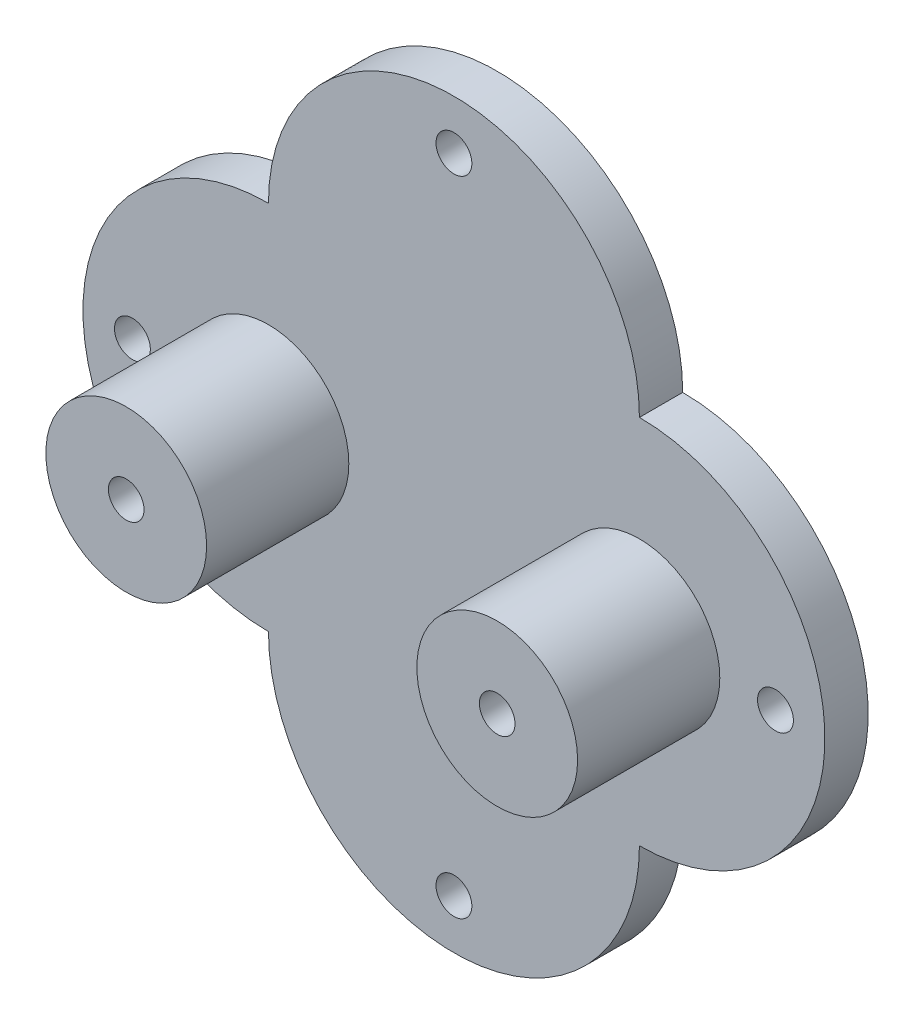
from build123d import *

# Parameters (mm, degrees)
EXTRUDE_9_DEPTH       = 2
SKETCH_5_R            = 6.5
SKETCH_5_R_2          = 1.44
EXTRUDE_11_DEPTH      = 9.7
EXTRUDE_12_DEPTH      = 3.5
SKETCH_5_4_R          = 6.5
SKETCH_5_4_R_2        = 1.44
EXTRUDE_13_DEPTH      = 10
EXTRUDE_17_DEPTH      = 10
EXTRUDE_17_DEPTH_BACK = 2
SKETCH_5_8_R          = 6.5
SKETCH_5_8_R_2        = 1.44
SKETCH_5_11_R         = 6.5
SKETCH_5_11_R_2       = 1.44
EXTRUDE_18_DEPTH      = 13
EXTRUDE_19_DEPTH      = 3
SKETCH_6_R            = 1.45
CUT_EXTRUDE_1_DEPTH   = 3.5


with BuildPart() as part:
    # 草图2 → 凸台-拉伸9 (new body)
    with BuildSketch(Plane.XY):
        with BuildLine():
            ThreePointArc((15, 15), (0, 30), (-15, 15))
            ThreePointArc((-15, 15), (-30, 0), (-15, -15))
            ThreePointArc((-15, -15), (0, -30), (15, -15))
            ThreePointArc((15, -15), (30, 0), (15, 15))
        make_face()
    extrude(amount=EXTRUDE_9_DEPTH)

    # 草图5 → 凸台-拉伸11 (add)
    # profile 1 of 2: a face of its own
    with BuildSketch(Plane.XY.offset(2)):
        with Locations((-15, 0)):
            Circle(SKETCH_5_R)
        with Locations((-15, 0)):
            Circle(SKETCH_5_R_2, mode=Mode.SUBTRACT)
    # profile 2 of 2: a face of its own
    with BuildSketch(Plane.XY.offset(2)):
        with Locations((15, 0)):
            Circle(SKETCH_5_R)
        with Locations((15, 0)):
            Circle(SKETCH_5_R_2, mode=Mode.SUBTRACT)
    extrude(amount=EXTRUDE_11_DEPTH)

    # 草图2<17> → 凸台-拉伸12 (add)
    with BuildSketch(Plane.XY):
        with BuildLine():
            ThreePointArc((15, 15), (0, 30), (-15, 15))
            ThreePointArc((-15, 15), (-30, 0), (-15, -15))
            ThreePointArc((-15, -15), (0, -30), (15, -15))
            ThreePointArc((15, -15), (30, 0), (15, 15))
        make_face()
    extrude(amount=EXTRUDE_12_DEPTH)

    # 草图5<4> → 凸台-拉伸13 (add)
    # profile 1 of 2: a face of its own
    with BuildSketch(Plane.XY.offset(2)):
        with Locations((-15, 0)):
            Circle(SKETCH_5_4_R)
        with Locations((-15, 0)):
            Circle(SKETCH_5_4_R_2, mode=Mode.SUBTRACT)
    # profile 2 of 2: a face of its own
    with BuildSketch(Plane.XY.offset(2)):
        with Locations((15, 0)):
            Circle(SKETCH_5_4_R)
        with Locations((15, 0)):
            Circle(SKETCH_5_4_R_2, mode=Mode.SUBTRACT)
    extrude(amount=EXTRUDE_13_DEPTH)

    # 草图5<8> → 凸台-拉伸17 (add, two sides: drawn at the far end of the back side and taken through both)
    # profile 1 of 2: a face of its own
    with BuildSketch(Plane.XY.offset(2).offset(-EXTRUDE_17_DEPTH_BACK)):
        with Locations((-15, 0)):
            Circle(SKETCH_5_8_R)
        with Locations((-15, 0)):
            Circle(SKETCH_5_8_R_2, mode=Mode.SUBTRACT)
    # profile 2 of 2: a face of its own
    with BuildSketch(Plane.XY.offset(2).offset(-EXTRUDE_17_DEPTH_BACK)):
        with Locations((15, 0)):
            Circle(SKETCH_5_8_R)
        with Locations((15, 0)):
            Circle(SKETCH_5_8_R_2, mode=Mode.SUBTRACT)
    extrude(amount=EXTRUDE_17_DEPTH + EXTRUDE_17_DEPTH_BACK)

    # 草图5<11> → 凸台-拉伸18 (add)
    # profile 1 of 2: a face of its own
    with BuildSketch(Plane.XY.offset(2)):
        with Locations((-15, 0)):
            Circle(SKETCH_5_11_R)
        with Locations((-15, 0)):
            Circle(SKETCH_5_11_R_2, mode=Mode.SUBTRACT)
    # profile 2 of 2: a face of its own
    with BuildSketch(Plane.XY.offset(2)):
        with Locations((15, 0)):
            Circle(SKETCH_5_11_R)
        with Locations((15, 0)):
            Circle(SKETCH_5_11_R_2, mode=Mode.SUBTRACT)
    extrude(amount=EXTRUDE_18_DEPTH)

    # 草图2<18> → 凸台-拉伸19 (add)
    with BuildSketch(Plane.XY):
        with BuildLine():
            ThreePointArc((15, 15), (0, 30), (-15, 15))
            ThreePointArc((-15, 15), (-30, 0), (-15, -15))
            ThreePointArc((-15, -15), (0, -30), (15, -15))
            ThreePointArc((15, -15), (30, 0), (15, 15))
        make_face()
    extrude(amount=EXTRUDE_19_DEPTH)

    # 草图6 → 切除-拉伸1 (cut)
    with BuildSketch(Plane.XY.offset(3.5)):
        with Locations((0, 26)):
            Circle(SKETCH_6_R)
        with Locations((-26, 0)):
            Circle(SKETCH_6_R)
        with Locations((26, 0)):
            Circle(SKETCH_6_R)
        with Locations((0, -26)):
            Circle(SKETCH_6_R)
    extrude(amount=-CUT_EXTRUDE_1_DEPTH, mode=Mode.SUBTRACT)


solid = part.part
